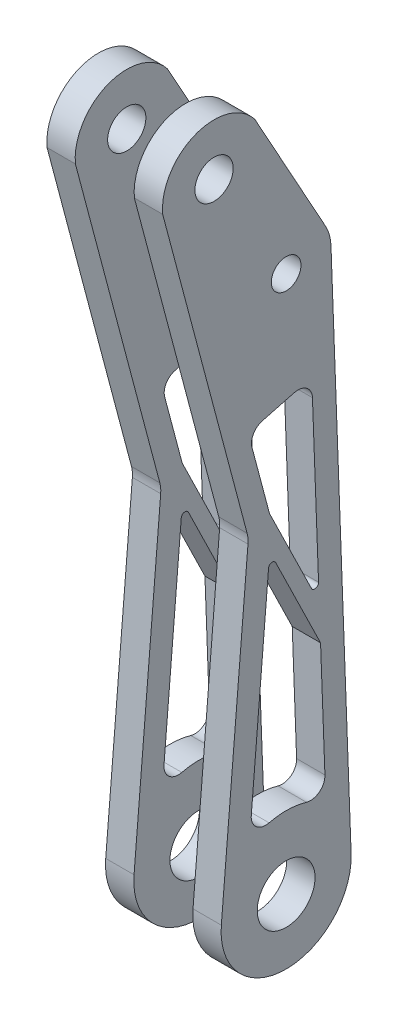
from build123d import *

# Parameters (mm, degrees)
SKETCH6_R           = 3.2639
SKETCH6_R_2         = 4.19989
BOSS_EXTRUDE3_DEPTH = 12.7
SKETCH7_R           = 6.35
CUT_EXTRUDE1_DEPTH  = 7.14375
SKETCH8_R           = 7.9375
CUT_EXTRUDE2_DEPTH  = 5.55625
CUT_EXTRUDE3_DEPTH  = 29.21
CUT_EXTRUDE5_DEPTH  = 25.4
FILLET2_R           = 3.175
FILLET3_R           = 3.175
BOSS_EXTRUDE4_DEPTH = 6.223
FILLET4_R           = 0.8255
BOSS_EXTRUDE5_DEPTH = 6.223
FILLET6_R           = 0.8255


with BuildPart() as part:
    # Sketch6 → Boss-Extrude3 (new, symmetric)
    with BuildSketch(Plane(origin=(0, 0, 0), x_dir=(0, 0, -1), z_dir=(1, 0, 0))):
        with BuildLine():
            Line((-8.381868112, 70.779690611), (-14.237180291, 1.198062439))
            ThreePointArc((-14.237180291, 1.198062439), (-0.331752192, -14.283647879), (14.277450567, 0.53578125))
            Line((14.277450567, 0.53578125), (11.553393182, 73.126217476))
            Line((11.553393182, 73.126217476), (9.854739755, 118.39178125))
            ThreePointArc((9.854739755, 118.39178125), (9.530289118, 120.556972634), (8.73611616, 122.597220477))
            Line((8.73611616, 122.597220477), (-6.910022509, 150.896463863))
            ThreePointArc((-6.910022509, 150.896463863), (-20.007377725, 154.453271456), (-27.124133067, 142.897174048))
            Line((-27.124133067, 142.897174048), (-8.571671953, 72.939897507))
            ThreePointArc((-8.571671953, 72.939897507), (-8.383873897, 71.86795626), (-8.381868112, 70.779690611))
        make_face()
        with Locations((0, 118.021968393)):
            Circle(SKETCH6_R, mode=Mode.SUBTRACT)
        with Locations((-15.837385813, 143.915751317)):
            Circle(SKETCH6_R_2, mode=Mode.SUBTRACT)
    extrude(amount=BOSS_EXTRUDE3_DEPTH, both=True)

    # Sketch7 → Cut-Extrude1 (cut)
    with BuildSketch(Plane(origin=(12.7, 0, 0), x_dir=(0, 0, -1), z_dir=(1, 0, 0))):
        Circle(SKETCH7_R)
    cut_extrude1 = extrude(amount=-CUT_EXTRUDE1_DEPTH, mode=Mode.SUBTRACT)

    # Sketch8 → Cut-Extrude2 (cut)
    with BuildSketch(Plane(origin=(5.55625, 0, 0), x_dir=(0, 0, -1), z_dir=(1, 0, 0))):
        Circle(SKETCH8_R)
    cut_extrude2 = extrude(amount=-CUT_EXTRUDE2_DEPTH, mode=Mode.SUBTRACT)

    # Mirror1: Cut-Extrude2 across plane
    add(cut_extrude2.mirror(Plane(origin=(0, 0, 0), x_dir=(0, 0, 1), z_dir=(1, 0, 0))), mode=Mode.SUBTRACT)

    # Mirror2: Cut-Extrude1 across plane
    add(cut_extrude1.mirror(Plane(origin=(0, 0, 0), x_dir=(0, 0, 1), z_dir=(1, 0, 0))), mode=Mode.SUBTRACT)

    # Sketch10 → Cut-Extrude3 (cut, symmetric)
    with BuildSketch(Plane(origin=(0, 0, 14.237180291), x_dir=(-1, 0, 0), z_dir=(0, 0, -1))):
        with BuildLine():
            Line((-6.477, 155.976463863), (-6.477, -18.648536137))
            ThreePointArc((-6.477, -18.648536137), (-5.54706403, -20.893600167), (-3.302, -21.823536137))
            Line((-3.302, -21.823536137), (3.302, -21.823536137))
            ThreePointArc((3.302, -21.823536137), (5.54706403, -20.893600167), (6.477, -18.648536137))
            Line((6.477, -18.648536137), (6.477, 155.976463863))
            Line((6.477, 155.976463863), (-6.477, 155.976463863))
        make_face()
    extrude(amount=CUT_EXTRUDE3_DEPTH, both=True, mode=Mode.SUBTRACT)


with BuildPart() as cut_extrude3_piece_1:
    # of the separate pieces the step leaves, piece 1, a body of its own (cut_extrude3_pieces)
    add(part.part.solids().sort_by_distance((-6.477, 142.897174048, 27.124133067))[0])


with BuildPart() as cut_extrude3_piece_2:
    # of the separate pieces the step leaves, piece 2, a body of its own (cut_extrude3_pieces)
    add(part.part.solids().sort_by_distance((12.7, 142.897174048, 27.124133067))[0])


with BuildPart() as cut_extrude5_tool:
    # Sketch13 → Cut-Extrude5 (new body)
    with BuildSketch(Plane(origin=(12.7, 0, 0), x_dir=(0, 0, -1), z_dir=(1, 0, 0))):
        with BuildLine():
            Line((-3.661406478, 74.242085268), (-8.323485823, 91.821767662))
            Line((-8.323485823, 91.821767662), (5.62938354, 95.522027008))
            Line((5.62938354, 95.522027008), (8.716072329, 13.26822174))
            ThreePointArc((8.716072329, 13.26822174), (0.368613547, 15.870719866), (-8.090670188, 13.658575362))
            Line((-8.090670188, 13.658575362), (-3.319759564, 70.353712855))
            ThreePointArc((-3.319759564, 70.353712855), (-3.323369976, 72.312591024), (-3.661406478, 74.242085268))
        make_face()
    extrude(amount=-CUT_EXTRUDE5_DEPTH)


with BuildPart() as cut_extrude3_piece_1_1:
    add(cut_extrude3_piece_1.part)

    # Cut-Extrude5: cut by cut_extrude5_tool
    add(cut_extrude5_tool.part, mode=Mode.SUBTRACT)

    # Fillet2
    fillet2_edges = [cut_extrude3_piece_1_1.edges().sort_by_distance(p)[0] for p in [
        (-9.5885, 91.821767662, 8.323485823),
        (-9.5885, 95.522027008, -5.62938354),
        (-9.5885, 13.26822174, -8.716072329),
        (-9.5885, 13.658575362, 8.090670188),
    ]]
    fillet(fillet2_edges, radius=FILLET2_R)

    # Sketch23 → Boss-Extrude5 (add)
    with BuildSketch(Plane(origin=(-12.7, 0, -12.7), x_dir=(0, 0, -1), z_dir=(1, 0, 0))):
        with BuildLine():
            Line((-16.361406478, 74.242085268), (-5.432185966, 51.861278542))
            Line((-5.432185966, 51.861278542), (-5.138058737, 44.023402597))
            Line((-5.138058737, 44.023402597), (-16.310243165, 66.901749696))
            Line((-16.310243165, 66.901749696), (-16.019759564, 70.353712855))
            ThreePointArc((-16.019759564, 70.353712855), (-16.023369976, 72.312591024), (-16.361406478, 74.242085268))
        make_face()
    extrude(amount=BOSS_EXTRUDE5_DEPTH)

    # Fillet6
    fillet6_edges = [cut_extrude3_piece_1_1.edges().sort_by_distance(p)[0] for p in [
        (-9.5885, 66.901749696, 3.610243165),
        (-9.5885, 51.861278542, -7.267814034),
    ]]
    fillet(fillet6_edges, radius=FILLET6_R)


with BuildPart() as cut_extrude3_piece_2_1:
    add(cut_extrude3_piece_2.part)

    # Cut-Extrude5: cut by cut_extrude5_tool
    add(cut_extrude5_tool.part, mode=Mode.SUBTRACT)

    # Fillet3
    fillet3_edges = [cut_extrude3_piece_2_1.edges().sort_by_distance(p)[0] for p in [
        (9.5885, 91.821767662, 8.323485823),
        (9.5885, 95.522027008, -5.62938354),
        (9.5885, 13.26822174, -8.716072329),
        (9.5885, 13.658575362, 8.090670188),
    ]]
    fillet(fillet3_edges, radius=FILLET3_R)

    # Sketch21 → Boss-Extrude4 (add)
    with BuildSketch(Plane(origin=(12.7, 0, 0), x_dir=(0, 0, -1), z_dir=(1, 0, 0))):
        with BuildLine():
            Line((-3.661406478, 74.242085268), (7.267814034, 51.861278542))
            Line((7.267814034, 51.861278542), (7.561941263, 44.023402597))
            Line((7.561941263, 44.023402597), (-3.610243165, 66.901749696))
            Line((-3.610243165, 66.901749696), (-3.319759564, 70.353712855))
            ThreePointArc((-3.319759564, 70.353712855), (-3.323369976, 72.312591024), (-3.661406478, 74.242085268))
        make_face()
    extrude(amount=-BOSS_EXTRUDE4_DEPTH)

    # Fillet4
    fillet4_edges = [cut_extrude3_piece_2_1.edges().sort_by_distance(p)[0] for p in [
        (9.5885, 66.901749696, 3.610243165),
        (9.5885, 51.861278542, -7.267814034),
    ]]
    fillet(fillet4_edges, radius=FILLET4_R)


solid = Compound([cut_extrude3_piece_1_1.part, cut_extrude3_piece_2_1.part])
